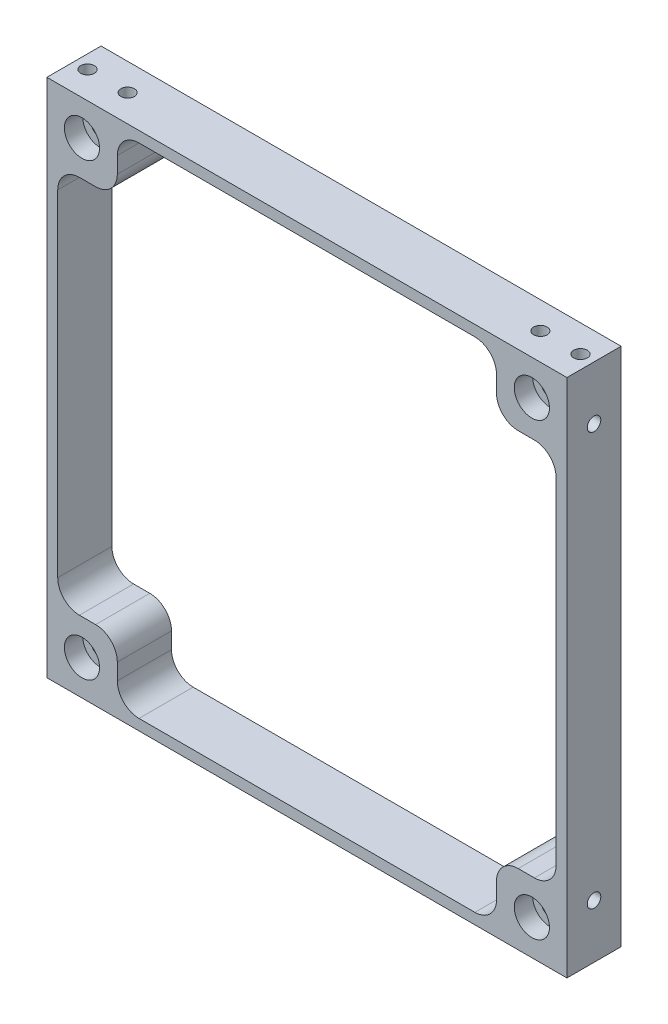
from build123d import *

# Parameters (mm, degrees)
BOTTOMLAYER_DEPTH                                   = 10
CBORE_FOR_M3_HEX_SOCKET_HEAD_CAP_SCREW1_D           = 3.4
CBORE_FOR_M3_HEX_SOCKET_HEAD_CAP_SCREW1_CBORE_D     = 6.5
CBORE_FOR_M3_HEX_SOCKET_HEAD_CAP_SCREW1_CBORE_DEPTH = 3.4
CIRPATTERN1_COUNT                                   = 4
CUT_EXTRUDE1_START                                  = -3.4
SKETCH30_R                                          = 3.25
CUT_EXTRUDE1_DEPTH                                  = 3.4
CIRPATTERN2_COUNT                                   = 4


with BuildPart() as part:
    # Sketch3 → BottomLayer (new body)
    with BuildSketch(Plane.XY):
        with BuildLine():
            Line((0, 48), (48, 48))
            Line((48, 48), (48, 0))
            Line((48, 0), (46, 0))
            Line((46, 0), (46, 31))
            ThreePointArc((46, 31), (44.828427125, 33.828427125), (42, 35))
            Line((42, 35), (39, 35))
            ThreePointArc((39, 35), (36.171572875, 36.171572875), (35, 39))
            Line((35, 39), (35, 42))
            ThreePointArc((35, 42), (33.828427125, 44.828427125), (31, 46))
            Line((31, 46), (0, 46))
            Line((0, 46), (0, 48))
        make_face()
    bottomlayer = extrude(amount=BOTTOMLAYER_DEPTH)

    # CBORE for M3 Hex Socket Head Cap Screw1 (through all)
    with Locations(Plane.XY.offset(10)):
        with Locations((41.525, 41.525)):
            cbore_for_m3_hex_socket_head_cap_screw1 = CounterBoreHole(CBORE_FOR_M3_HEX_SOCKET_HEAD_CAP_SCREW1_D / 2, CBORE_FOR_M3_HEX_SOCKET_HEAD_CAP_SCREW1_CBORE_D / 2, CBORE_FOR_M3_HEX_SOCKET_HEAD_CAP_SCREW1_CBORE_DEPTH)

    # CirPattern1: BottomLayer, CBORE for M3 Hex Socket Head Cap Screw1 ×4 about axis
    cirpattern1_axis = Axis((0, 0, -0.5), (0, 0, 1))
    add([bottomlayer.rotate(cirpattern1_axis, i * 360 / CIRPATTERN1_COUNT) for i in range(1, CIRPATTERN1_COUNT)])
    add([cbore_for_m3_hex_socket_head_cap_screw1.rotate(cirpattern1_axis, i * 360 / CIRPATTERN1_COUNT) for i in range(1, CIRPATTERN1_COUNT)], mode=Mode.SUBTRACT)

    # Sketch21 → Tap Drill M3 Side Plate (revolve, cut)
    with BuildSketch(Plane(origin=(48, 38.1, 5), x_dir=(0, 0, -1), z_dir=(0, 1, 0))):
        Polygon((0, 0), (0, 5.751075774), (1.25, 5), (1.25, 0), align=None)
    tap_drill_m3_side_plate = revolve(axis=Axis((54.35, 38.1, 5), (-1, 0, 0)), mode=Mode.SUBTRACT)

    # Sketch27 → Tap Drill M3 Side Plate 2 (revolve, cut)
    with BuildSketch(Plane(origin=(38.1, 48, 5), x_dir=(0, 0, 1), z_dir=(1, 0, 0))):
        Polygon((0, 0), (0, 5.751075774), (1.25, 5), (1.25, 0), align=None)
    tap_drill_m3_side_plate_2 = revolve(axis=Axis((38.1, 54.35, 5), (0, -1, 0)), mode=Mode.SUBTRACT)

    # Sketch29 → Tap Drill M3 Rail (revolve, cut)
    with BuildSketch(Plane(origin=(45.5, 48, 5), x_dir=(0, 0, 1), z_dir=(1, 0, 0))):
        Polygon((0, 0), (0, 5.751075774), (1.25, 5), (1.25, 0), align=None)
    tap_drill_m3_rail = revolve(axis=Axis((45.5, 54.35, 5), (0, -1, 0)), mode=Mode.SUBTRACT)

    # SidePlate and Rail Holes 1: Tap Drill M3 Side Plate, Tap Drill M3 Side Plate 2, Tap Drill M3 Rail across plane
    add(tap_drill_m3_side_plate.mirror(Plane(origin=(0, 0, 0), x_dir=(0, 0, 1), z_dir=(1, 0, 0))), mode=Mode.SUBTRACT)
    add(tap_drill_m3_side_plate_2.mirror(Plane(origin=(0, 0, 0), x_dir=(0, 0, 1), z_dir=(1, 0, 0))), mode=Mode.SUBTRACT)
    add(tap_drill_m3_rail.mirror(Plane(origin=(0, 0, 0), x_dir=(0, 0, 1), z_dir=(1, 0, 0))), mode=Mode.SUBTRACT)

    # Side Plate and Rail Holes 2 copy 1 sketc → Side Plate and Rail Holes 2 copy 1 (revolve, cut)
    with BuildSketch(Plane(origin=(-48, -38.1, 5), x_dir=(0, 0, -1), z_dir=(0, -1, 0))):
        Polygon((0, 0), (0, 5.751075774), (1.25, 5), (1.25, 0), align=None)
    revolve(axis=Axis((-54.35, -38.1, 5), (1, 0, 0)), mode=Mode.SUBTRACT)

    # Side Plate and Rail Holes 2 copy 2 sketc → Side Plate and Rail Holes 2 copy 2 (revolve, cut)
    with BuildSketch(Plane(origin=(-38.1, -48, 5), x_dir=(0, 0, 1), z_dir=(-1, 0, 0))):
        Polygon((0, 0), (0, 5.751075774), (1.25, 5), (1.25, 0), align=None)
    revolve(axis=Axis((-38.1, -54.35, 5), (0, 1, 0)), mode=Mode.SUBTRACT)

    # Side Plate and Rail Holes 2 copy 3 sketc → Side Plate and Rail Holes 2 copy 3 (revolve, cut)
    with BuildSketch(Plane(origin=(-45.5, -48, 5), x_dir=(0, 0, 1), z_dir=(-1, 0, 0))):
        Polygon((0, 0), (0, 5.751075774), (1.25, 5), (1.25, 0), align=None)
    revolve(axis=Axis((-45.5, -54.35, 5), (0, 1, 0)), mode=Mode.SUBTRACT)

    # Side Plate and Rail Holes 2 copy 4 sketc → Side Plate and Rail Holes 2 copy 4 (revolve, cut)
    with BuildSketch(Plane(origin=(48, -38.1, 5), x_dir=(0, 0, -1), z_dir=(0, -1, 0))):
        Polygon((0, 0), (0, -5.751075774), (1.25, -5), (1.25, 0), align=None)
    revolve(axis=Axis((54.35, -38.1, 5), (1, 0, 0)), mode=Mode.SUBTRACT)

    # Side Plate and Rail Holes 2 copy 5 sketc → Side Plate and Rail Holes 2 copy 5 (revolve, cut)
    with BuildSketch(Plane(origin=(38.1, -48, 5), x_dir=(0, 0, 1), z_dir=(1, 0, 0))):
        Polygon((0, 0), (0, -5.751075774), (1.25, -5), (1.25, 0), align=None)
    revolve(axis=Axis((38.1, -54.35, 5), (0, -1, 0)), mode=Mode.SUBTRACT)

    # Side Plate and Rail Holes 2 copy 6 sketc → Side Plate and Rail Holes 2 copy 6 (revolve, cut)
    with BuildSketch(Plane(origin=(45.5, -48, 5), x_dir=(0, 0, 1), z_dir=(1, 0, 0))):
        Polygon((0, 0), (0, -5.751075774), (1.25, -5), (1.25, 0), align=None)
    revolve(axis=Axis((45.5, -54.35, 5), (0, -1, 0)), mode=Mode.SUBTRACT)

    # Sketch30 → Cut-Extrude1 (cut)
    with BuildSketch(Plane(origin=(0, 0, 0), x_dir=(-1, 0, 0), z_dir=(0, 0, -1)).offset(CUT_EXTRUDE1_START)):
        with Locations((-41.525, 41.525)):
            Circle(SKETCH30_R)
    cut_extrude1 = extrude(amount=CUT_EXTRUDE1_DEPTH, mode=Mode.SUBTRACT)

    # CirPattern2: Cut-Extrude1 ×4 about axis
    cirpattern2_axis = Axis((0, 0, -0.5), (0, 0, 1))
    for i in range(1, CIRPATTERN2_COUNT):
        add(cut_extrude1.rotate(cirpattern2_axis, i * 360 / CIRPATTERN2_COUNT), mode=Mode.SUBTRACT)


solid = part.part
